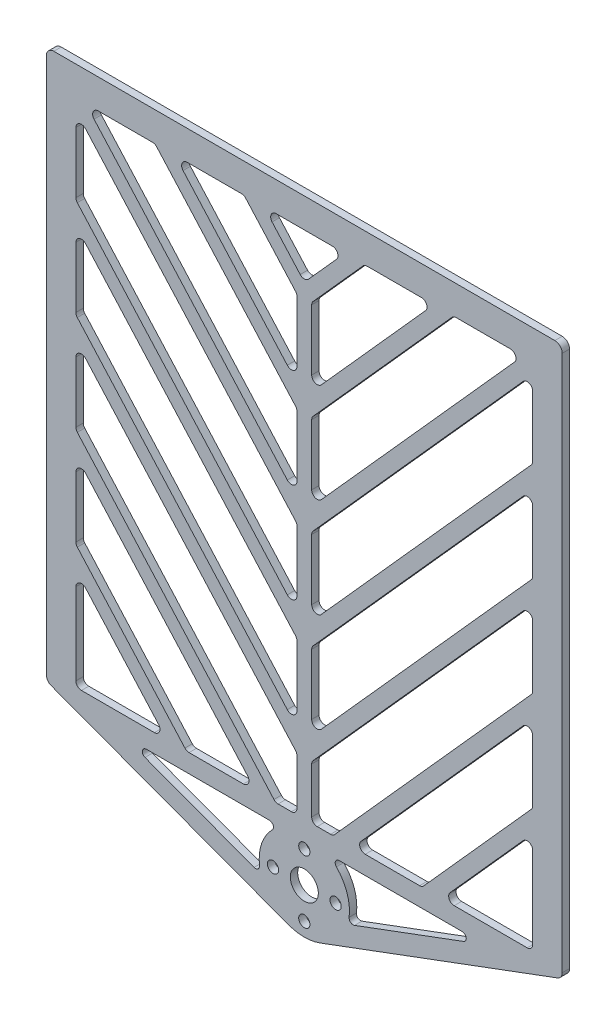
from build123d import *

# Parameters (mm, degrees)
SKETCH_1_W          = 140
SKETCH_1_H          = 149
EXTRUDE_1_DEPTH     = 2
EXTRUDE_2_DEPTH     = 2
FILLET_1_R          = 2
SKETCH_4_R          = 1.525
CUT_EXTRUDE_1_DEPTH = 2
CUT_EXTRUDE_3_DEPTH = 2
CUT_EXTRUDE_4_DEPTH = 2
FILLET_3_R          = 1.5
SKETCH_7_R          = 3.8
CUT_EXTRUDE_5_DEPTH = 22
CUT_EXTRUDE_START   = -22
CUT_EXTRUDE_6_DEPTH = 22
FILLET_4_R          = 1.1


with BuildPart() as part:
    # 草图1 → 凸台-拉伸1 (new body)
    with BuildSketch(Plane.XY):
        Rectangle(SKETCH_1_W, SKETCH_1_H)
    extrude(amount=EXTRUDE_1_DEPTH)

    # 草图2 → 凸台-拉伸2 (add)
    with BuildSketch(Plane.XY.offset(2)):
        with BuildLine():
            Line((-70, -74.5), (-4.275674814, -98.979595153))
            ThreePointArc((-4.275674814, -98.979595153), (0, -99.75), (4.275674814, -98.979595153))
            Line((4.275674814, -98.979595153), (70, -74.5))
            Line((70, -74.5), (-70, -74.5))
        make_face()
    extrude(amount=-EXTRUDE_2_DEPTH)

    # 圆角1
    fillet_1_edges = [part.edges().sort_by_distance(p)[0] for p in [
        (70, -74.5, 1),
        (-70, -74.5, 1),
        (-70, 74.5, 1),
        (70, 74.5, 1),
    ]]
    fillet(fillet_1_edges, radius=FILLET_1_R)

    # 草图4 → 切除-拉伸1 (cut)
    with BuildSketch(Plane(origin=(0, 0, 0), x_dir=(-1, 0, 0), z_dir=(0, 0, -1))):
        with Locations((8.5, -87.5)):
            Circle(SKETCH_4_R)
        with Locations((0, -96)):
            Circle(SKETCH_4_R)
        with Locations((-8.5, -87.5)):
            Circle(SKETCH_4_R)
        with Locations((0, -79)):
            Circle(SKETCH_4_R)
    extrude(amount=-CUT_EXTRUDE_1_DEPTH, mode=Mode.SUBTRACT)

    # 草图5 → 切除-拉伸3 (cut)
    with BuildSketch(Plane(origin=(0, 0, 0), x_dir=(-1, 0, 0), z_dir=(0, 0, -1))):
        Polygon((62, -44.439423724), (37.324827016, -72), (62, -72), align=None)
        Polygon((62, -17.454158494), (13.164733958, -72), (31.955917448, -72), (62, -38.442698117), align=None)
        Polygon((62, 9.531106736), (2, -57.485022296), (2, -72), (7.79582439, -72), (62, -11.457432887), align=None)
        Polygon((62, 36.516371966), (2, -30.499757066), (2, -51.488296689), (62, 15.527832343), align=None)
        Polygon((62, 63.501637197), (2, -3.514491836), (2, -24.503031459), (62, 42.513097573), align=None)
        Polygon((40.524361726, 66.5), (2, 23.470773395), (2, 2.482233771), (59.315545216, 66.5), align=None)
        Polygon((16.364268668, 66.5), (2, 50.456038625), (2, 29.467499001), (35.155452158, 66.5), align=None)
    cut_extrude_3 = extrude(amount=-CUT_EXTRUDE_3_DEPTH, mode=Mode.SUBTRACT)

    # 镜向1: 切除-拉伸3 across plane
    add(cut_extrude_3.mirror(Plane(origin=(0, 0, 0), x_dir=(0, 0, 1), z_dir=(1, 0, 0))), mode=Mode.SUBTRACT)

    # 草图6 → 切除-拉伸4 (cut)
    with BuildSketch(Plane.XY.offset(2)):
        Polygon((-10.9953591, 66.5), (10.9953591, 66.5), (0, 54.218893264), align=None)
    extrude(amount=-CUT_EXTRUDE_4_DEPTH, mode=Mode.SUBTRACT)

    # 圆角3
    fillet_3_edges = [part.edges().sort_by_distance(p)[0] for p in [
        (-2, -30.499757066, 1),
        (-62, 36.516371966, 1),
        (-62, 15.527832343, 1),
        (-2, -51.488296689, 1),
        (-2, -3.514491836, 1),
        (-62, 63.501637197, 1),
        (-62, 42.513097573, 1),
        (-2, -24.503031459, 1),
        (-62, -38.442698117, 1),
        (-31.955917448, -72, 1),
        (-13.164733958, -72, 1),
        (-62, -17.454158494, 1),
        (-2, -57.485022296, 1),
        (-62, 9.531106736, 1),
        (-62, -11.457432887, 1),
        (-7.79582439, -72, 1),
        (-2, -72, 1),
        (-2, 50.456038625, 1),
        (-16.364268668, 66.5, 1),
        (-35.155452158, 66.5, 1),
        (-2, 29.467499001, 1),
        (-2, 23.470773395, 1),
        (-40.524361726, 66.5, 1),
        (-59.315545216, 66.5, 1),
        (-2, 2.482233771, 1),
        (-62, -44.439423724, 1),
        (-62, -72, 1),
        (-37.324827016, -72, 1),
        (62, 15.527832343, 1),
        (2, -51.488296689, 1),
        (2, -30.499757066, 1),
        (62, 36.516371966, 1),
        (62, 42.513097573, 1),
        (2, -24.503031459, 1),
        (2, -3.514491836, 1),
        (62, 63.501637197, 1),
        (13.164733958, -72, 1),
        (62, -17.454158494, 1),
        (62, -38.442698117, 1),
        (31.955917448, -72, 1),
        (62, -11.457432887, 1),
        (7.79582439, -72, 1),
        (2, -72, 1),
        (2, -57.485022296, 1),
        (62, 9.531106736, 1),
        (35.155452158, 66.5, 1),
        (2, 29.467499001, 1),
        (2, 50.456038625, 1),
        (16.364268668, 66.5, 1),
        (59.315545216, 66.5, 1),
        (2, 2.482233771, 1),
        (2, 23.470773395, 1),
        (40.524361726, 66.5, 1),
        (37.324827016, -72, 1),
        (62, -44.439423724, 1),
        (62, -72, 1),
        (10.9953591, 66.5, 1),
        (-10.9953591, 66.5, 1),
        (0, 54.218893264, 1),
    ]]
    fillet(fillet_3_edges, radius=FILLET_3_R)

    # 草图7 → 切除-拉伸5 (cut)
    with BuildSketch(Plane(origin=(0, 0, 0), x_dir=(-1, 0, 0), z_dir=(0, 0, -1))):
        with Locations((0, -87.5)):
            Circle(SKETCH_7_R)
    extrude(amount=-CUT_EXTRUDE_5_DEPTH, mode=Mode.SUBTRACT)

    # 草图8 → 切除-拉伸6 (cut)
    with BuildSketch(Plane(origin=(0, 0, 0), x_dir=(-1, 0, 0), z_dir=(0, 0, -1)).offset(CUT_EXTRUDE_START)):
        with BuildLine():
            Line((48.962621857, -77), (11.783719365, -90.847604805))
            ThreePointArc((11.783719365, -90.847604805), (11.392195972, -82.996626716), (6.309714732, -77))
            Line((6.309714732, -77), (48.962621857, -77))
        make_face()
    cut_extrude_6 = extrude(amount=CUT_EXTRUDE_6_DEPTH, mode=Mode.SUBTRACT)

    # 镜向2: 切除-拉伸6 across plane
    add(cut_extrude_6.mirror(Plane(origin=(0, 0, 0), x_dir=(0, 0, 1), z_dir=(1, 0, 0))), mode=Mode.SUBTRACT)

    # 圆角4
    fillet_4_edges = [part.edges().sort_by_distance(p)[0] for p in [
        (-6.309714732, -77, 1),
        (-48.962621857, -77, 1),
        (-11.783719365, -90.847604805, 1),
        (48.962621857, -77, 1),
        (6.309714732, -77, 1),
        (11.783719365, -90.847604805, 1),
    ]]
    fillet(fillet_4_edges, radius=FILLET_4_R)


solid = part.part
